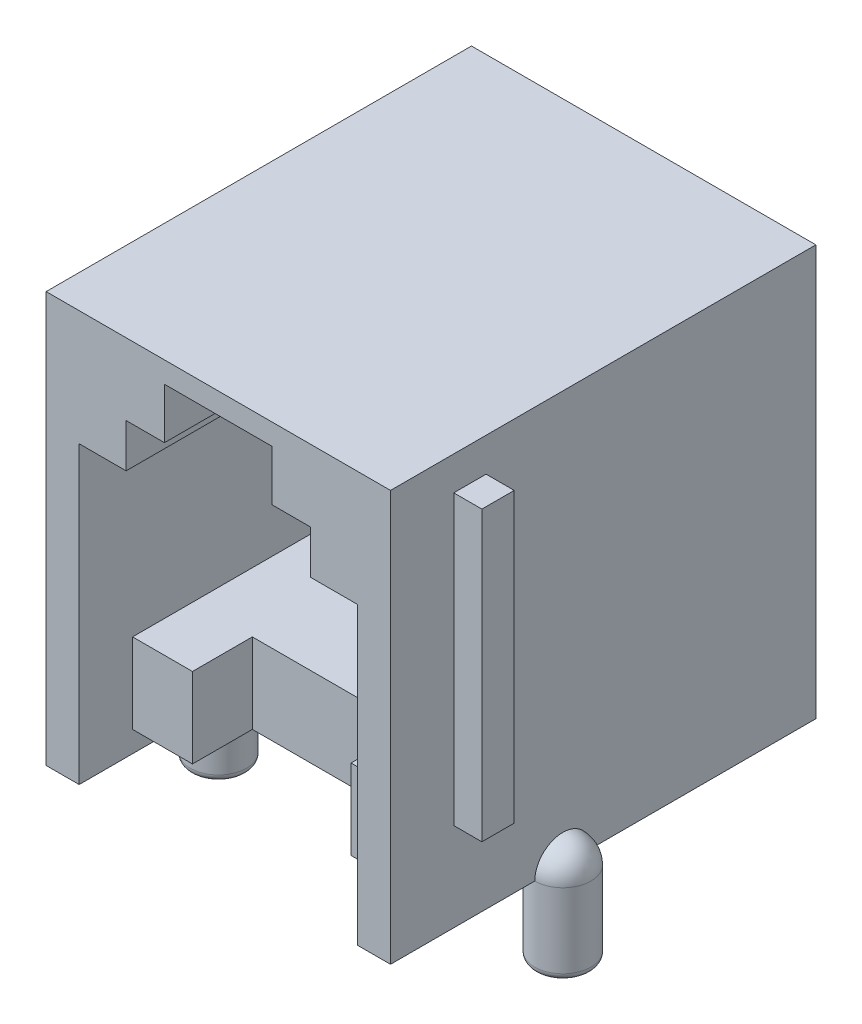
from build123d import *

# Parameters (mm, degrees)
SKETCH1_W           = 12.25
SKETCH1_H           = 14.6
BOSS_EXTRUDE1_DEPTH = 13.13
CUT_EXTRUDE1_DEPTH  = 12.07
SKETCH4_W           = 10.22
SKETCH4_H           = 1.85
CUT_EXTRUDE3_DEPTH  = 10.5
CUT_EXTRUDE4_REACH  = 18.224
SKETCH5_W           = 0.518
SKETCH5_H           = 6.3
SKETCH6_W           = 9.9
SKETCH6_H           = 3.6
CUT_EXTRUDE5_DEPTH  = 1.9
SKETCH10_W          = 5.64
SKETCH10_H          = 2.85
CUT_EXTRUDE7_DEPTH  = 2.13
SKETCH11_W          = 9.9
SKETCH11_H          = 0.75
CUT_EXTRUDE8_DEPTH  = 15.728154161
SKETCH12_R          = 1
BOSS_EXTRUDE2_DEPTH = 2.9
FILLET1_R           = 0.25
SKETCH15_W          = 0.5
SKETCH15_H          = 0.5
BOSS_EXTRUDE3_DEPTH = 3.7
CHAMFER1_SIZE       = 0.05
SKETCH16_W          = 9.9
SKETCH16_H          = 0.6
BOSS_EXTRUDE4_DEPTH = 0.75
SKETCH17_W          = 0.518
SKETCH17_H          = 6.3
SKETCH17_W_2        = 10.25
SKETCH17_H_2        = 1.85
BOSS_EXTRUDE5_DEPTH = 2
SKETCH18_W          = 1.15
SKETCH18_H          = 10.25
BOSS_EXTRUDE6_DEPTH = 1


with BuildPart() as part:
    # Sketch1 → Boss-Extrude1 (new body)
    with BuildSketch(Plane.XY):
        Rectangle(SKETCH1_W, SKETCH1_H)
    extrude(amount=BOSS_EXTRUDE1_DEPTH)

    # Sketch2 → Cut-Extrude1 (cut)
    with BuildSketch(Plane.XY.offset(13.13)):
        Polygon((3.28, 3.2), (3.28, 4.75), (1.915, 4.75), (1.915, 6.55), (-1.915, 6.55), (-1.915, 4.75), (-3.28, 4.75), (-3.28, 3.2), (-4.95, 3.2), (-4.95, -3.7), (4.95, -3.7), (4.95, 3.2), align=None)
    extrude(amount=-CUT_EXTRUDE1_DEPTH, mode=Mode.SUBTRACT)

    # Sketch4 → Cut-Extrude3 (cut)
    with BuildSketch(Plane(origin=(0, 0, 0), x_dir=(-1, 0, 0), z_dir=(0, 0, -1))):
        with Locations((0, 5.375)):
            Rectangle(SKETCH4_W, SKETCH4_H)
    extrude(amount=-CUT_EXTRUDE3_DEPTH, mode=Mode.SUBTRACT)

    # Sketch5 → Cut-Extrude4 (cut, up to next)
    with BuildSketch(Plane(origin=(0, 0, 0), x_dir=(-1, 0, 0), z_dir=(0, 0, -1)), mode=Mode.PRIVATE) as cut_extrude4_sk1:
        with Locations((-1.555, -0.4)):
            Rectangle(SKETCH5_W, SKETCH5_H)
    cut_extrude4_tool1 = extrude(cut_extrude4_sk1.sketch, amount=-CUT_EXTRUDE4_REACH, mode=Mode.PRIVATE) & part.part
    # Sketch5 → Cut-Extrude4 (cut, up to next)
    with BuildSketch(Plane(origin=(0, 0, 0), x_dir=(-1, 0, 0), z_dir=(0, 0, -1)), mode=Mode.PRIVATE) as cut_extrude4_sk2:
        with Locations((-0.519, -0.4)):
            Rectangle(SKETCH5_W, SKETCH5_H)
    cut_extrude4_tool2 = extrude(cut_extrude4_sk2.sketch, amount=-CUT_EXTRUDE4_REACH, mode=Mode.PRIVATE) & part.part
    # Sketch5 → Cut-Extrude4 (cut, up to next)
    with BuildSketch(Plane(origin=(0, 0, 0), x_dir=(-1, 0, 0), z_dir=(0, 0, -1)), mode=Mode.PRIVATE) as cut_extrude4_sk3:
        with Locations((0.519, -0.4)):
            Rectangle(SKETCH5_W, SKETCH5_H)
    cut_extrude4_tool3 = extrude(cut_extrude4_sk3.sketch, amount=-CUT_EXTRUDE4_REACH, mode=Mode.PRIVATE) & part.part
    # Sketch5 → Cut-Extrude4 (cut, up to next)
    with BuildSketch(Plane(origin=(0, 0, 0), x_dir=(-1, 0, 0), z_dir=(0, 0, -1)), mode=Mode.PRIVATE) as cut_extrude4_sk4:
        with Locations((1.555, -0.4)):
            Rectangle(SKETCH5_W, SKETCH5_H)
    cut_extrude4_tool4 = extrude(cut_extrude4_sk4.sketch, amount=-CUT_EXTRUDE4_REACH, mode=Mode.PRIVATE) & part.part
    add(cut_extrude4_tool1.solids().sort_by_distance((1.555, -0.4, 0))[0], mode=Mode.SUBTRACT)
    add(cut_extrude4_tool2.solids().sort_by_distance((0.519, -0.4, 0))[0], mode=Mode.SUBTRACT)
    add(cut_extrude4_tool3.solids().sort_by_distance((-0.519, -0.4, 0))[0], mode=Mode.SUBTRACT)
    add(cut_extrude4_tool4.solids().sort_by_distance((-1.555, -0.4, 0))[0], mode=Mode.SUBTRACT)

    # Sketch6 → Cut-Extrude5 (cut)
    with BuildSketch(Plane.XY.offset(13.13)):
        with Locations((0, -5.5)):
            Rectangle(SKETCH6_W, SKETCH6_H)
    extrude(amount=-CUT_EXTRUDE5_DEPTH, mode=Mode.SUBTRACT)

    # Sketch10 → Cut-Extrude7 (cut)
    with BuildSketch(Plane.XY.offset(11.23)):
        with Locations((0, -5.125)):
            Rectangle(SKETCH10_W, SKETCH10_H)
    extrude(amount=-CUT_EXTRUDE7_DEPTH, mode=Mode.SUBTRACT)

    # Sketch11 → Cut-Extrude8 (cut, through all)
    with BuildSketch(Plane.XY.offset(11.23)):
        with Locations((0, -6.925)):
            Rectangle(SKETCH11_W, SKETCH11_H)
    extrude(amount=-CUT_EXTRUDE8_DEPTH, mode=Mode.SUBTRACT)

    # Sketch12 → Boss-Extrude2 (add)
    with BuildSketch(Plane.XZ.offset(7.3)):
        with Locations(Location((-6.125, 7, 0), (0, 0, 270))):
            Circle(SKETCH12_R)
        with Locations(Location((6.125, 7, 0), (0, 0, 90))):
            Circle(SKETCH12_R)
    extrude(amount=BOSS_EXTRUDE2_DEPTH)

    # Sketch13 → Revolve1 (revolve)
    with BuildSketch(Plane(origin=(6.125, 0, 0), x_dir=(0, 0, -1), z_dir=(1, 0, 0))):
        with BuildLine():
            Line((-7, -6.3), (-7, -7.3))
            Line((-7, -7.3), (-8, -7.3))
            ThreePointArc((-8, -7.3), (-7.707106781, -6.592893219), (-7, -6.3))
        make_face()
    revolve(axis=Axis((6.125, -6.3, 7), (0, -1, 0)))

    # Sketch14 → Revolve2 (revolve)
    with BuildSketch(Plane.ZY.offset(6.125)):
        with BuildLine():
            Line((7, -6.3), (7, -7.3))
            Line((7, -7.3), (6, -7.3))
            ThreePointArc((6, -7.3), (6.292893219, -6.592893219), (7, -6.3))
        make_face()
    revolve(axis=Axis((-6.125, -6.3, 7), (0, -1, 0)))

    # Fillet1
    fillet1_edges = [part.edges().sort_by_distance(p)[0] for p in [
        (-6.125, -10.2, 8),
        (6.125, -10.2, 6),
    ]]
    fillet(fillet1_edges, radius=FILLET1_R)

    # Sketch15 → Boss-Extrude3 (add)
    with BuildSketch(Plane.XZ.offset(6.55)):
        with Locations((-0.5, 4.5)):
            Rectangle(SKETCH15_W, SKETCH15_H)
        with Locations((-1.5, 2)):
            Rectangle(SKETCH15_W, SKETCH15_H)
        with Locations((0.5, 2)):
            Rectangle(SKETCH15_W, SKETCH15_H)
        with Locations((1.5, 4.5)):
            Rectangle(SKETCH15_W, SKETCH15_H)
    extrude(amount=BOSS_EXTRUDE3_DEPTH)

    # Chamfer1
    chamfer1_edges = [part.edges().sort_by_distance(p)[0] for p in [
        (-0.25, -10.25, 4.5),
        (-0.5, -10.25, 4.75),
        (-0.75, -10.25, 4.5),
        (-0.5, -10.25, 4.25),
        (-1.25, -10.25, 2),
        (-1.5, -10.25, 2.25),
        (-1.75, -10.25, 2),
        (-1.5, -10.25, 1.75),
        (0.75, -10.25, 2),
        (0.5, -10.25, 2.25),
        (0.25, -10.25, 2),
        (0.5, -10.25, 1.75),
        (1.75, -10.25, 4.5),
        (1.5, -10.25, 4.75),
        (1.25, -10.25, 4.5),
        (1.5, -10.25, 4.25),
    ]]
    chamfer(chamfer1_edges, length=CHAMFER1_SIZE)

    # Sketch16 → Boss-Extrude4 (add)
    with BuildSketch(Plane.XZ.offset(6.55)):
        with Locations((0, 7)):
            Rectangle(SKETCH16_W, SKETCH16_H)
    extrude(amount=BOSS_EXTRUDE4_DEPTH)

    # Sketch17 → Boss-Extrude5 (add)
    with BuildSketch(Plane(origin=(0, 0, 0), x_dir=(-1, 0, 0), z_dir=(0, 0, -1))):
        Polygon((-6.125, 7.3), (6.125, 7.3), (6.125, -7.3), (5.125, -7.3), (5.125, -4.3), (-5.125, -4.3), (-5.125, -7.3), (-6.125, -7.3), align=None)
        with Locations((-1.555, -0.4)):
            Rectangle(SKETCH17_W, SKETCH17_H, mode=Mode.SUBTRACT)
        with Locations((-0.519, -0.4)):
            Rectangle(SKETCH17_W, SKETCH17_H, mode=Mode.SUBTRACT)
        with Locations((0.519, -0.4)):
            Rectangle(SKETCH17_W, SKETCH17_H, mode=Mode.SUBTRACT)
        with Locations((1.555, -0.4)):
            Rectangle(SKETCH17_W, SKETCH17_H, mode=Mode.SUBTRACT)
        with Locations((0, 5.375)):
            Rectangle(SKETCH17_W_2, SKETCH17_H_2, mode=Mode.SUBTRACT)
    extrude(amount=BOSS_EXTRUDE5_DEPTH)

    # Sketch18 → Boss-Extrude6 (add)
    with BuildSketch(Plane(origin=(6.125, 0, 0), x_dir=(0, 0, -1), z_dir=(1, 0, 0))):
        with Locations((-10.305, 0.975)):
            Rectangle(SKETCH18_W, SKETCH18_H)
    boss_extrude6 = extrude(amount=BOSS_EXTRUDE6_DEPTH)

    # Mirror1: Boss-Extrude6 across plane
    add(boss_extrude6.mirror(Plane(origin=(0, 0, 0), x_dir=(0, 0, 1), z_dir=(1, 0, 0))))


solid = part.part
